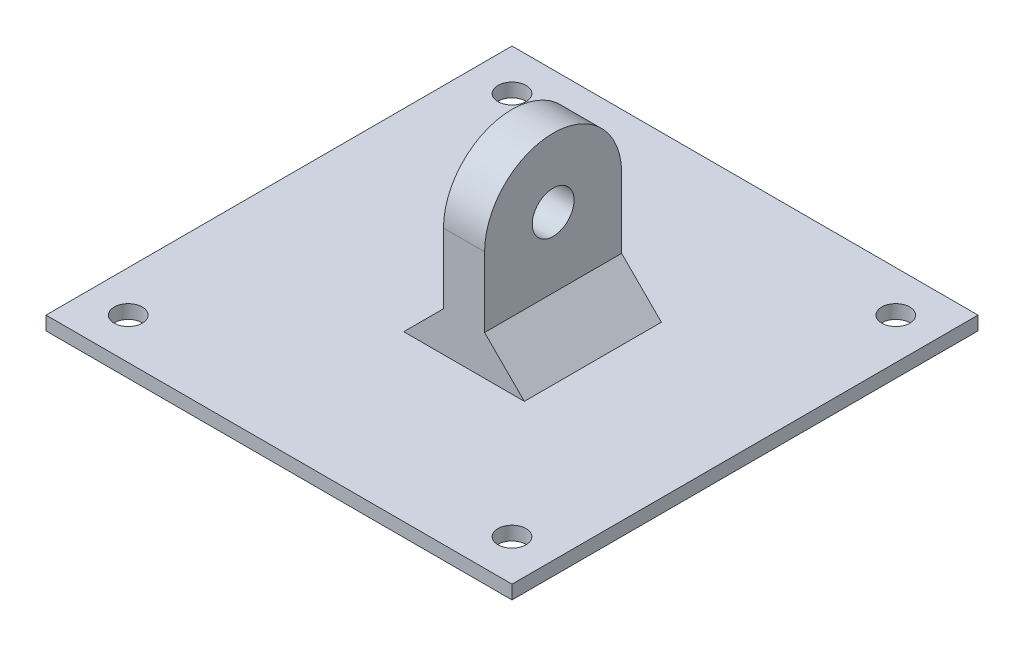
from build123d import *

# Parameters (mm, degrees)
SKETCH1_W           = 34
SKETCH1_H           = 34
SKETCH1_R           = 1.025
BOSS_EXTRUDE1_DEPTH = 1
SKETCH4_R           = 1.525
BOSS_EXTRUDE2_DEPTH = 3
CHAMFER1_SIZE       = 2.9


with BuildPart() as part:
    # Sketch1 → Boss-Extrude1 (new body)
    with BuildSketch(Plane(origin=(0, 0, 0), x_dir=(1, 0, 0), z_dir=(0, 1, 0))):
        Rectangle(SKETCH1_W, SKETCH1_H)
        with Locations(Location((-14, 14, 0), (0, 0, 270))):
            Circle(SKETCH1_R, mode=Mode.SUBTRACT)
        with Locations(Location((14, 14, 0), (0, 0, 270))):
            Circle(SKETCH1_R, mode=Mode.SUBTRACT)
        with Locations(Location((14, -14, 0), (0, 0, 270))):
            Circle(SKETCH1_R, mode=Mode.SUBTRACT)
        with Locations(Location((-14, -14, 0), (0, 0, 270))):
            Circle(SKETCH1_R, mode=Mode.SUBTRACT)
    extrude(amount=BOSS_EXTRUDE1_DEPTH)

    # Sketch4 → Boss-Extrude2 (add)
    with BuildSketch(Plane(origin=(0, 0, 0), x_dir=(0, 0, -1), z_dir=(1, 0, 0))):
        with BuildLine():
            Line((-5, 1), (5, 1))
            Line((5, 1), (5, 9))
            ThreePointArc((5, 9), (0, 14), (-5, 9))
            Line((-5, 9), (-5, 1))
        make_face()
        with Locations((0, 9)):
            Circle(SKETCH4_R, mode=Mode.SUBTRACT)
    extrude(amount=BOSS_EXTRUDE2_DEPTH)

    # Chamfer1
    chamfer1_edges = [part.edges().sort_by_distance(p)[0] for p in [
        (3, 1, 0),
        (0, 1, 0),
    ]]
    chamfer(chamfer1_edges, length=CHAMFER1_SIZE)


solid = part.part
